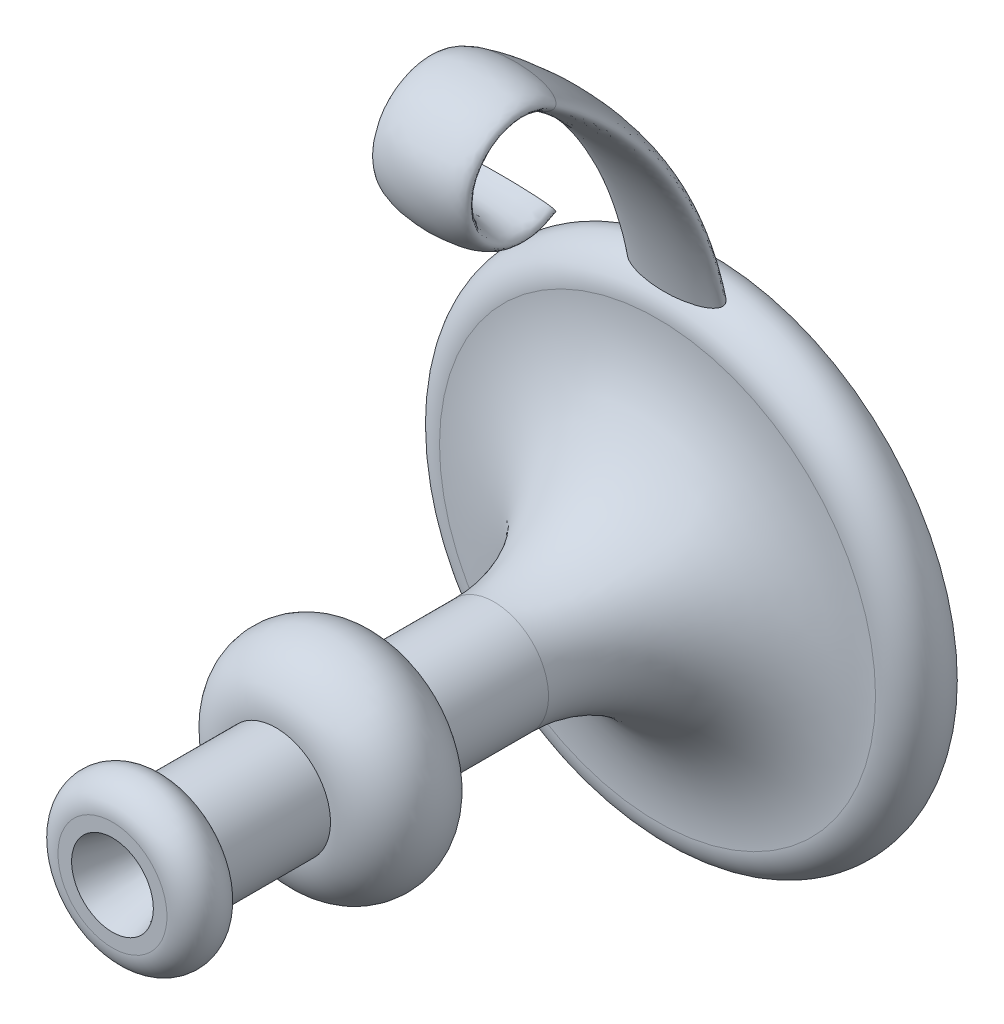
from build123d import *

# Parameters (mm, degrees)
SKETCH6_RX         = 17.5
SKETCH6_RY         = 5
SKETCH7_R          = 15
CUT_EXTRUDE1_DEPTH = 25
CUT_EXTRUDE1_DRAFT = -15


with BuildPart() as part:
    # Sketch1 → Revolve1 (revolve)
    with BuildSketch(Plane.YZ, mode=Mode.PRIVATE) as revolve1_sk:
        with BuildLine():
            Line((0, 0), (0, 220))
            Line((0, 220), (20, 220))
            ThreePointArc((20, 220), (30, 210), (20, 200))
            Line((20, 200), (20, 160))
            ThreePointArc((20, 160), (40, 140), (20, 120))
            Line((20, 120), (20, 80))
            ThreePointArc((20, 80), (37.573593129, 37.573593129), (80, 20))
            ThreePointArc((80, 20), (91.180339887, 13.090169944), (90, 0))
            Line((90, 0), (0, 0))
        make_face()
    revolve(revolve1_sk.sketch.rotate(Axis((0, 0, 0), (0, 0, 1)), 90), axis=Axis((0, 0, 0), (0, 0, 1)))

    # Sweep1: sweep along a path in Sketch5
    with BuildLine(Plane.YZ) as sweep1_path:
        Line((0, 10), (60, 10))
        ThreePointArc((60, 10), (129.821200219, 27.240819526), (183.592070943, 75))
        ThreePointArc((183.592070943, 75), (167.113128151, 106.333333333), (150.634185358, 75))
    # Sketch6 → Sweep1 (sweep)
    with BuildSketch(Plane(origin=(0, 0, 0), x_dir=(-1, 0, 0), z_dir=(0, 1, 0))):
        with Locations(Location((0, 10), (0, 0, 180))):
            Ellipse(SKETCH6_RX, SKETCH6_RY)
    sweep(path=sweep1_path.line)


with BuildPart() as cut_extrude1_tool:
    # Sketch7 → Cut-Extrude1 (with draft: the straight prism first)
    with BuildSketch(Plane.XY.offset(220)):
        Circle(SKETCH7_R)
    extrude(amount=-CUT_EXTRUDE1_DEPTH)
    # Cut-Extrude1: the draft: its side faces are tilted about the plane it starts from
    cut_extrude1_sides = [cut_extrude1_tool.faces().sort_by_distance(p)[0] for p in [
        (-15, 0, 207.5),
    ]]
    draft(cut_extrude1_sides, Plane.XY.offset(220), CUT_EXTRUDE1_DRAFT)


with BuildPart() as part_1:
    add(part.part)

    # Cut-Extrude1: cut by cut_extrude1_tool
    add(cut_extrude1_tool.part, mode=Mode.SUBTRACT)


solid = part_1.part
